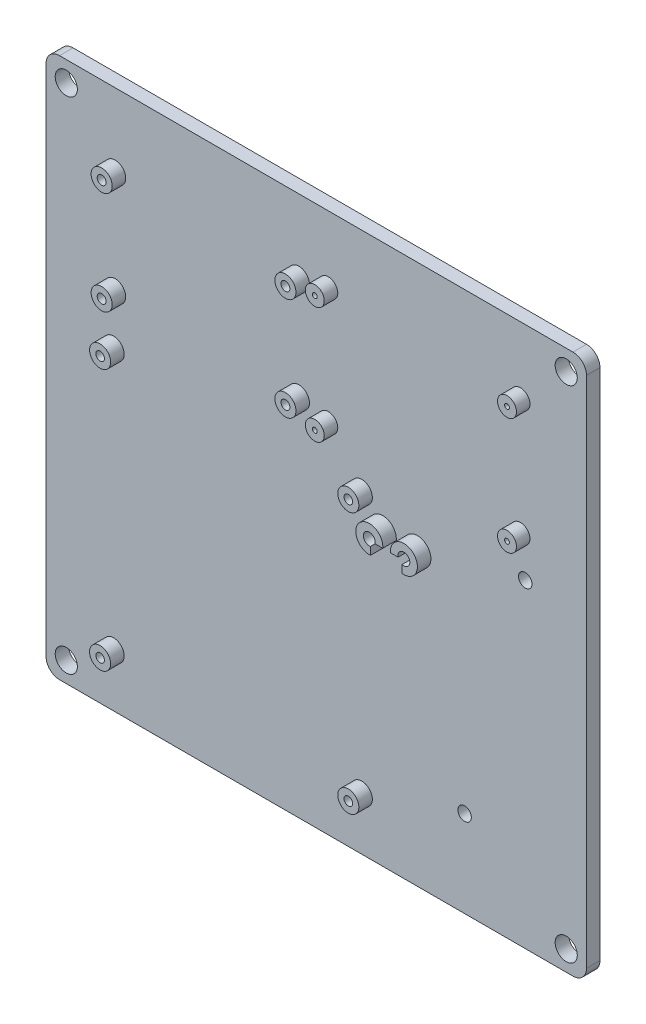
from build123d import *

# Parameters (mm, degrees)
CROQUIS1_W              = 200
CROQUIS1_H              = 200
SALIENTE_EXTRUIR1_DEPTH = 5
CROQUIS4_R              = 3.5
CROQUIS4_R_2            = 0.9
CROQUIS4_R_3            = 3.9
CROQUIS4_R_4            = 1.4
SALIENTE_EXTRUIR3_DEPTH = 5
REDONDEO1_R             = 5
CROQUIS5_R              = 4.1
CORTAR_EXTRUIR1_DEPTH   = 5
CROQUIS7_R              = 2.5
CORTAR_EXTRUIR2_DEPTH   = 10
CROQUIS8_R              = 2.2
CROQUIS8_R_2            = 1.5875
CROQUIS8_R_3            = 1.65
CORTAR_EXTRUIR3_DEPTH   = 17


with BuildPart() as part:
    # Croquis1 → Saliente-Extruir1 (new body)
    with BuildSketch(Plane(origin=(0, 0, 0), x_dir=(0, 1, 0), z_dir=(0, 0, 1))):
        Rectangle(CROQUIS1_W, CROQUIS1_H)
    extrude(amount=SALIENTE_EXTRUIR1_DEPTH)

    # Croquis4 → Saliente-Extruir3 (add)
    # profile 1 of 14: a face of its own
    with BuildSketch(Plane.XY.offset(5)):
        with Locations((4.466366134, 32.184176934)):
            Circle(CROQUIS4_R)
        with Locations((4.466366134, 32.184176934)):
            Circle(CROQUIS4_R_2, mode=Mode.SUBTRACT)
    # profile 2 of 14: a face of its own
    with BuildSketch(Plane.XY.offset(5)):
        with Locations(Location((75.586508374, 75.364263295, 0), (0, 0, 180))):
            Circle(CROQUIS4_R)
        with Locations((75.586508374, 75.364263295)):
            Circle(CROQUIS4_R_2, mode=Mode.SUBTRACT)
    # profile 3 of 14: a face of its own
    with BuildSketch(Plane.XY.offset(5)):
        with Locations(Location((-74.976542636, 16.226296077, 0), (0, 0, 180))):
            Circle(CROQUIS4_R_3)
        with Locations((-74.976542636, 16.226296077)):
            Circle(CROQUIS4_R_4, mode=Mode.SUBTRACT)
    # profile 4 of 14: a face of its own
    with BuildSketch(Plane.XY.offset(5)):
        with Locations(Location((16.86819811, 16.226296077, 0), (0, 0, 180))):
            Circle(CROQUIS4_R_3)
        with Locations((16.86819811, 16.226296077)):
            Circle(CROQUIS4_R_4, mode=Mode.SUBTRACT)
    # profile 5 of 14: a face of its own
    with BuildSketch(Plane.XY.offset(5)):
        with Locations(Location((16.86819811, -80.452378393, 0), (0, 0, 180))):
            Circle(CROQUIS4_R_3)
        with Locations((16.86819811, -80.452378393)):
            Circle(CROQUIS4_R_4, mode=Mode.SUBTRACT)
    # profile 6 of 14: a face of its own
    with BuildSketch(Plane.XY.offset(5)):
        with Locations(Location((-74.976542636, -80.452378393, 0), (0, 0, 180))):
            Circle(CROQUIS4_R_3)
        with Locations((-74.976542636, -80.452378393)):
            Circle(CROQUIS4_R_4, mode=Mode.SUBTRACT)
    # profile 7 of 14: a face of its own
    with BuildSketch(Plane.XY.offset(5)):
        with Locations(Location((-6.408510904, 72.92167992, 0), (0, 0, 180))):
            Circle(CROQUIS4_R_3)
        with Locations((-6.408510904, 72.92167992)):
            Circle(CROQUIS4_R_4, mode=Mode.SUBTRACT)
    # profile 8 of 14: a face of its own
    with BuildSketch(Plane.XY.offset(5)):
        with Locations(Location((-6.408510904, 34.92167992, 0), (0, 0, 180))):
            Circle(CROQUIS4_R_3)
        with Locations((-6.408510904, 34.92167992)):
            Circle(CROQUIS4_R_4, mode=Mode.SUBTRACT)
    # profile 9 of 14: a face of its own
    with BuildSketch(Plane.XY.offset(5)):
        with Locations(Location((-74.408510904, 34.92167992, 0), (0, 0, 180))):
            Circle(CROQUIS4_R_3)
        with Locations((-74.408510904, 34.92167992)):
            Circle(CROQUIS4_R_4, mode=Mode.SUBTRACT)
    # profile 10 of 14: a face of its own
    with BuildSketch(Plane.XY.offset(5)):
        with Locations(Location((4.466366134, 75.364263295, 0), (0, 0, 180))):
            Circle(CROQUIS4_R)
        with Locations((4.466366134, 75.364263295)):
            Circle(CROQUIS4_R_2, mode=Mode.SUBTRACT)
    # profile 11 of 14: a face of its own
    with BuildSketch(Plane.XY.offset(5)):
        with Locations(Location((75.586508374, 32.184176934, 0), (0, 0, 180))):
            Circle(CROQUIS4_R)
        with Locations((75.586508374, 32.184176934)):
            Circle(CROQUIS4_R_2, mode=Mode.SUBTRACT)
    # profile 12 of 14: a face of its own
    with BuildSketch(Plane.XY.offset(5)):
        with Locations(Location((-74.408510904, 72.92167992, 0), (0, 0, 180))):
            Circle(CROQUIS4_R_3)
        with Locations((-74.408510904, 72.92167992)):
            Circle(CROQUIS4_R_4, mode=Mode.SUBTRACT)
    # profile 13 of 14: a face of its own
    with BuildSketch(Plane.XY.offset(5)):
        with BuildLine():
            Line((32.455622465, 6.933114513), (36.757832016, 6.933114513))
            Line((36.757832016, 6.933114513), (36.757832016, 2.449848629))
            ThreePointArc((36.757832016, 2.449848629), (41.041030118, 10.865935643), (32.455622465, 6.933114513))
        make_face()
    # profile 14 of 14: a face of its own
    with BuildSketch(Plane.XY.offset(5)):
        with BuildLine():
            Line((29.611177214, 6.933114513), (25.086009497, 6.933114513))
            Line((25.086009497, 6.933114513), (25.086009497, 2.424526913))
            ThreePointArc((25.086009497, 2.424526913), (21.104360825, 10.946016112), (29.611177214, 6.933114513))
        make_face()
    extrude(amount=SALIENTE_EXTRUIR3_DEPTH)

    # Redondeo1
    redondeo1_edges = [part.edges().sort_by_distance(p)[0] for p in [
        (100, 100, 2.5),
        (100, -100, 2.5),
        (-100, -100, 2.5),
        (-100, 100, 2.5),
    ]]
    fillet(redondeo1_edges, radius=REDONDEO1_R)

    # Croquis5 → Cortar-Extruir1 (cut)
    with BuildSketch(Plane(origin=(0, 0, 5), x_dir=(0, -1, 0), z_dir=(0, 0, 1))):
        with Locations(Location((-92.5, -92.5, 0), (0, 0, 90))):
            Circle(CROQUIS5_R)
        with Locations(Location((92.5, -92.5, 0), (0, 0, 90))):
            Circle(CROQUIS5_R)
        with Locations(Location((92.5, 92.5, 0), (0, 0, 90))):
            Circle(CROQUIS5_R)
        with Locations(Location((-92.5, 92.5, 0), (0, 0, 90))):
            Circle(CROQUIS5_R)
    extrude(amount=-CORTAR_EXTRUIR1_DEPTH, mode=Mode.SUBTRACT)

    # Croquis7 → Cortar-Extruir2 (cut)
    with BuildSketch(Plane(origin=(0, 0, 0), x_dir=(1, 0, 0), z_dir=(0, 0, -1))):
        with Locations(Location((77.341864461, -18.038506913, 0), (0, 0, 180))):
            Circle(CROQUIS7_R)
        with Locations(Location((54.891864461, 67.961493087, 0), (0, 0, 180))):
            Circle(CROQUIS7_R)
    extrude(amount=-CORTAR_EXTRUIR2_DEPTH, mode=Mode.SUBTRACT)

    # Croquis8 → Cortar-Extruir3 (cut)
    with BuildSketch(Plane.XY.offset(10)):
        with Locations(Location((37.433399839, 7.403999224, 0), (0, 0, 252.116878215))):
            Circle(CROQUIS8_R)
        with Locations(Location((24.633399839, 7.403999224, 0), (0, 0, 347.64087537))):
            Circle(CROQUIS8_R)
        with Locations((-74.976542636, -80.452378393)):
            Circle(CROQUIS8_R_2)
        with Locations((16.86819811, -80.452378393)):
            Circle(CROQUIS8_R_2)
        with Locations((16.86819811, 16.226296077)):
            Circle(CROQUIS8_R_2)
        with Locations((-74.976542636, 16.226296077)):
            Circle(CROQUIS8_R_2)
        with Locations((-6.408510904, 34.92167992)):
            Circle(CROQUIS8_R_3)
        with Locations((-6.408510904, 72.92167992)):
            Circle(CROQUIS8_R_3)
        with Locations((-74.408510904, 72.92167992)):
            Circle(CROQUIS8_R_3)
        with Locations((-74.408510904, 34.92167992)):
            Circle(CROQUIS8_R_3)
    extrude(amount=-CORTAR_EXTRUIR3_DEPTH, mode=Mode.SUBTRACT)


solid = part.part
